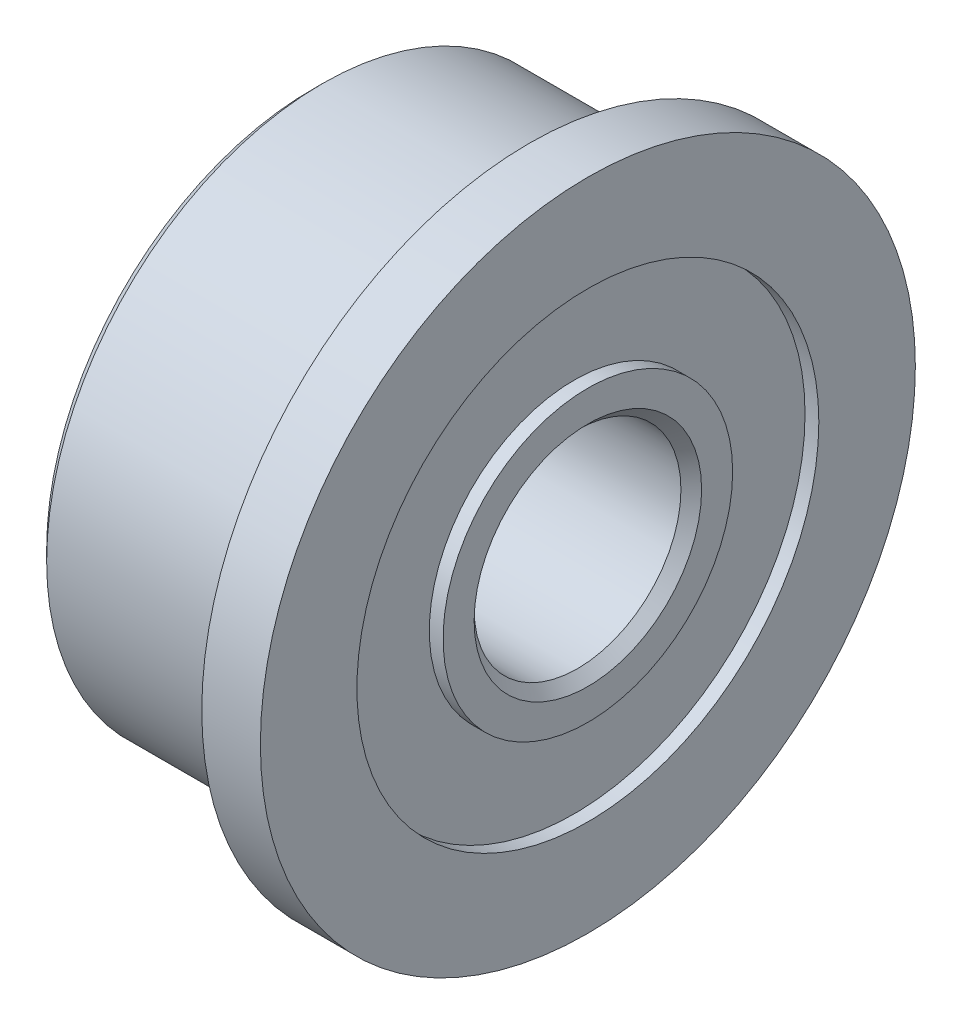
from build123d import *

# Parameters (mm, degrees)
CHAMFER1_SIZE = 0.15


with BuildPart() as part:
    # Sketch1 → Revolve1 (revolve)
    with BuildSketch(Plane.XY, mode=Mode.PRIVATE) as revolve1_sk:
        with BuildLine():
            Line((-4, 1.5), (0, 1.5))
            Line((0, 1.5), (0, 2.1))
            Line((0, 2.1), (-0.2, 2.1))
            Line((-0.2, 2.1), (-0.2, 3.35))
            Line((-0.2, 3.35), (0, 3.35))
            Line((0, 3.35), (0, 4.75))
            Line((0, 4.75), (-0.85, 4.75))
            Line((-0.85, 4.75), (-0.85, 4.02))
            ThreePointArc((-0.85, 4.02), (-0.835857864, 3.985857864), (-0.87, 4))
            Line((-0.87, 4), (-4, 4))
            Line((-4, 4), (-4, 3.35))
            Line((-4, 3.35), (-3.8, 3.35))
            Line((-3.8, 3.35), (-3.8, 2.1))
            Line((-3.8, 2.1), (-4, 2.1))
            Line((-4, 2.1), (-4, 1.5))
        make_face()
    revolve(revolve1_sk.sketch.rotate(Axis((0, 0, 0), (-1, 0, 0)), 90), axis=Axis((0, 0, 0), (-1, 0, 0)))

    # Chamfer1
    chamfer1_edges = [part.edges().sort_by_distance(p)[0] for p in [
        (-4, 0, 4),
        (0, 0, 1.5),
        (-4, 0, 1.5),
    ]]
    chamfer(chamfer1_edges, length=CHAMFER1_SIZE)


solid = part.part
